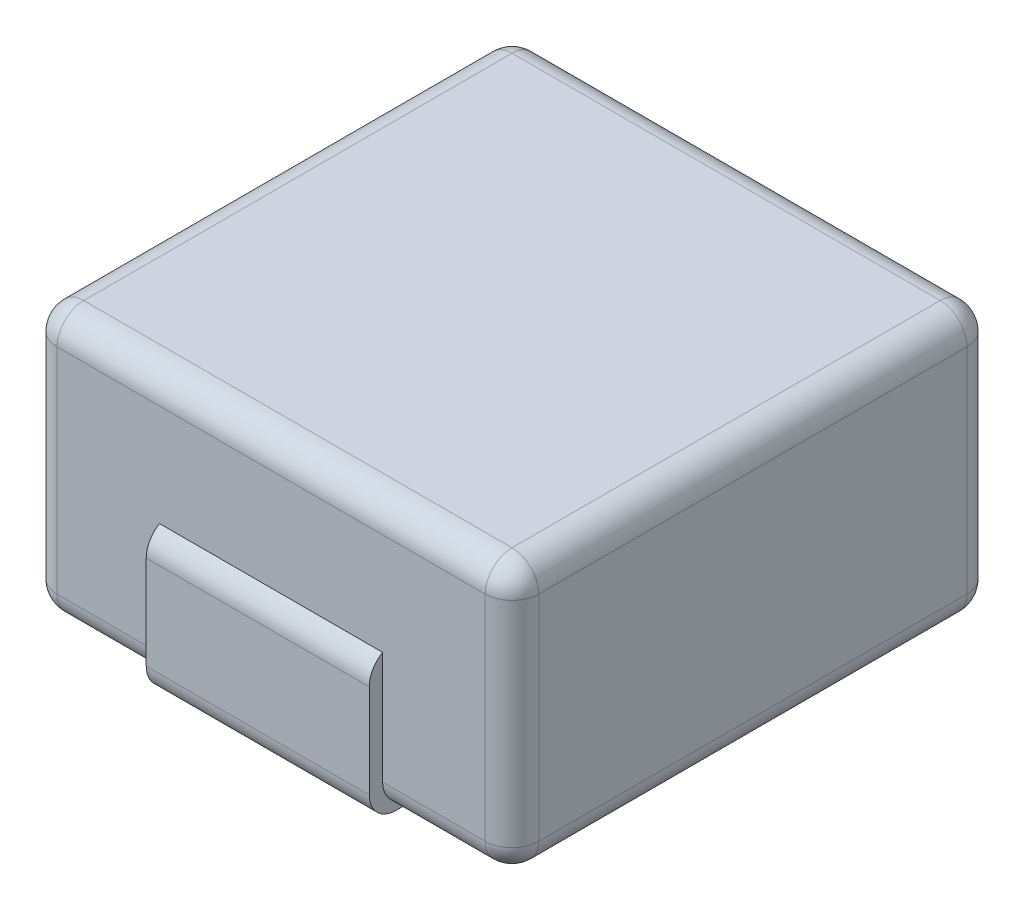
from build123d import *

# Parameters (mm, degrees)
SKETCH_1_W             = 5.4
SKETCH_1_H             = 5.4
EXTRUDE_1_DEPTH        = 3
FILLET_1_R             = 0.3
EXTRUDE_2_DEPTH        = 0.05
EXTRUDE_2_DEPTH_BACK   = 1.6
SKETCH_2_W             = 2.5
SKETCH_2_H             = 1.4
EXTRUDE_2_2_DEPTH      = 0.05
EXTRUDE_2_2_DEPTH_BACK = 1.6
FILLET_2_R             = 0.3
FILLET_3_R             = 0.3


with BuildPart() as part:
    # Эскиз1 → Бобышка-Вытянуть1 (new body)
    with BuildSketch(Plane(origin=(0, 0.05, 0), x_dir=(1, 0, 0), z_dir=(0, 1, 0))):
        Rectangle(SKETCH_1_W, SKETCH_1_H)
    extrude(amount=EXTRUDE_1_DEPTH)

    # Скругление1
    fillet_1_edges = [part.edges().sort_by_distance(p)[0] for p in [
        (-2.7, 3.05, 0),
        (0, 3.05, 2.7),
        (2.7, 3.05, 0),
        (0, 0.05, 2.7),
        (-2.7, 0.05, 0),
        (0, 0.05, -2.7),
        (2.7, 0.05, 0),
        (0, 3.05, -2.7),
        (2.7, 1.55, 2.7),
        (-2.7, 1.55, 2.7),
        (-2.7, 1.55, -2.7),
        (2.7, 1.55, -2.7),
    ]]
    fillet(fillet_1_edges, radius=FILLET_1_R)


with BuildPart() as body_2:
    # Эскиз2 → Бобышка-Вытянуть2 (new, two sides: drawn at the far end of the back side and taken through both)
    with BuildSketch(Plane.XZ.offset(-0.05).offset(-EXTRUDE_2_DEPTH_BACK)):
        with Locations((0, 2.15)):
            Rectangle(SKETCH_2_W, SKETCH_2_H)
    extrude(amount=EXTRUDE_2_DEPTH + EXTRUDE_2_DEPTH_BACK)

    # Скругление2
    fillet_2_edges = [body_2.edges().sort_by_distance(p)[0] for p in [
        (0, 1.65, 2.85),
        (0, 0, 2.85),
    ]]
    fillet(fillet_2_edges, radius=FILLET_2_R)


with BuildPart() as body_3:
    # Эскиз2 → Extrude 2 2 (new, two sides: drawn at the far end of the back side and taken through both)
    with BuildSketch(Plane.XZ.offset(-0.05).offset(-EXTRUDE_2_2_DEPTH_BACK)):
        with Locations((0, -2.15)):
            Rectangle(SKETCH_2_W, SKETCH_2_H)
    extrude(amount=EXTRUDE_2_2_DEPTH + EXTRUDE_2_2_DEPTH_BACK)

    # Скругление3
    fillet_3_edges = [body_3.edges().sort_by_distance(p)[0] for p in [
        (0, 0, -2.85),
        (0, 1.65, -2.85),
    ]]
    fillet(fillet_3_edges, radius=FILLET_3_R)


solid = Compound([part.part, body_2.part, body_3.part])
